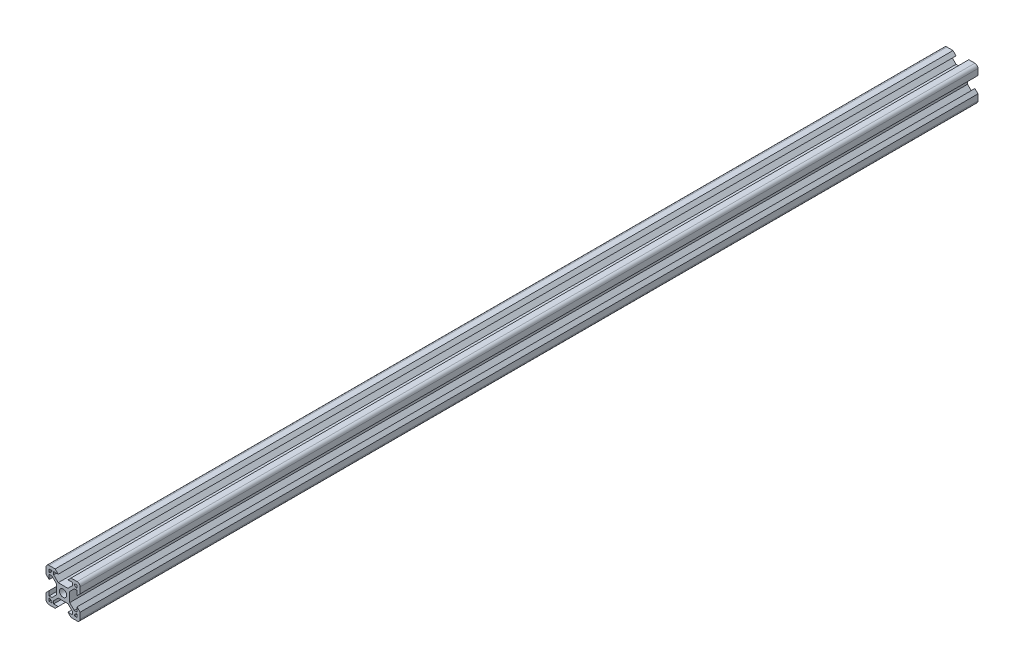
from build123d import *

# Parameters (mm, degrees)
SKETCH1_R      = 2.1
EXTRUDE1_DEPTH = 262.95


with BuildPart() as part:
    # Sketch1 → Extrude1 (new, symmetric)
    with BuildSketch(Plane.XY):
        with BuildLine():
            Line((-3.900660172, 0), (-3.900660172, -2.84))
            Line((-3.900660172, -2.84), (-6.56, -5.499339828))
            Line((-6.56, -5.499339828), (-8.2, -5.499339828))
            Line((-8.2, -5.499339828), (-8.2, -2.84))
            Line((-8.2, -2.84), (-10, -4.64))
            Line((-10, -4.64), (-10, -8.2))
            ThreePointArc((-10, -8.2), (-9.472792206, -9.472792206), (-8.2, -10))
            Line((-8.2, -10), (-4.64, -10))
            Line((-4.64, -10), (-2.84, -8.2))
            Line((-2.84, -8.2), (-5.499339828, -8.2))
            Line((-5.499339828, -8.2), (-5.499339828, -6.56))
            Line((-5.499339828, -6.56), (-2.84, -3.900660172))
            Line((-2.84, -3.900660172), (0, -3.900660172))
            Line((0, -3.900660172), (2.84, -3.900660172))
            Line((2.84, -3.900660172), (5.499339828, -6.56))
            Line((5.499339828, -6.56), (5.499339828, -8.2))
            Line((5.499339828, -8.2), (2.84, -8.2))
            Line((2.84, -8.2), (4.64, -10))
            Line((4.64, -10), (8.2, -10))
            ThreePointArc((8.2, -10), (9.472792206, -9.472792206), (10, -8.2))
            Line((10, -8.2), (10, -4.64))
            Line((10, -4.64), (8.2, -2.84))
            Line((8.2, -2.84), (8.2, -5.499339828))
            Line((8.2, -5.499339828), (6.56, -5.499339828))
            Line((6.56, -5.499339828), (3.900660172, -2.84))
            Line((3.900660172, -2.84), (3.900660172, 0))
            Line((3.900660172, 0), (3.900660172, 2.84))
            Line((3.900660172, 2.84), (6.56, 5.499339828))
            Line((6.56, 5.499339828), (8.2, 5.499339828))
            Line((8.2, 5.499339828), (8.2, 2.84))
            Line((8.2, 2.84), (10, 4.64))
            Line((10, 4.64), (10, 8.2))
            ThreePointArc((10, 8.2), (9.472792206, 9.472792206), (8.2, 10))
            Line((8.2, 10), (4.64, 10))
            Line((4.64, 10), (2.84, 8.2))
            Line((2.84, 8.2), (5.499339828, 8.2))
            Line((5.499339828, 8.2), (5.499339828, 6.56))
            Line((5.499339828, 6.56), (2.84, 3.900660172))
            Line((2.84, 3.900660172), (0, 3.900660172))
            Line((0, 3.900660172), (-2.84, 3.900660172))
            Line((-2.84, 3.900660172), (-5.499339828, 6.56))
            Line((-5.499339828, 6.56), (-5.499339828, 8.2))
            Line((-5.499339828, 8.2), (-2.84, 8.2))
            Line((-2.84, 8.2), (-4.64, 10))
            Line((-4.64, 10), (-8.2, 10))
            ThreePointArc((-8.2, 10), (-9.472792206, 9.472792206), (-10, 8.2))
            Line((-10, 8.2), (-10, 4.64))
            Line((-10, 4.64), (-8.2, 2.84))
            Line((-8.2, 2.84), (-8.2, 5.499339828))
            Line((-8.2, 5.499339828), (-6.56, 5.499339828))
            Line((-6.56, 5.499339828), (-3.900660172, 2.84))
            Line((-3.900660172, 2.84), (-3.900660172, 0))
        make_face()
        Circle(SKETCH1_R, mode=Mode.SUBTRACT)
        Polygon((-8.2, -8.2), (-8.2, -6.569339828), (-7.63, -6.569339828), (-6.569339828, -7.63), (-6.569339828, -8.2), align=None, mode=Mode.SUBTRACT)
        Polygon((-8.2, 6.569339828), (-8.2, 8.2), (-6.569339828, 8.2), (-6.569339828, 7.63), (-7.63, 6.569339828), align=None, mode=Mode.SUBTRACT)
        Polygon((6.569339828, 8.2), (8.2, 8.2), (8.2, 6.569339828), (7.63, 6.569339828), (6.569339828, 7.63), align=None, mode=Mode.SUBTRACT)
        Polygon((8.2, -6.569339828), (8.2, -8.2), (6.569339828, -8.2), (6.569339828, -7.63), (7.63, -6.569339828), align=None, mode=Mode.SUBTRACT)
    extrude(amount=EXTRUDE1_DEPTH, both=True)


solid = part.part
